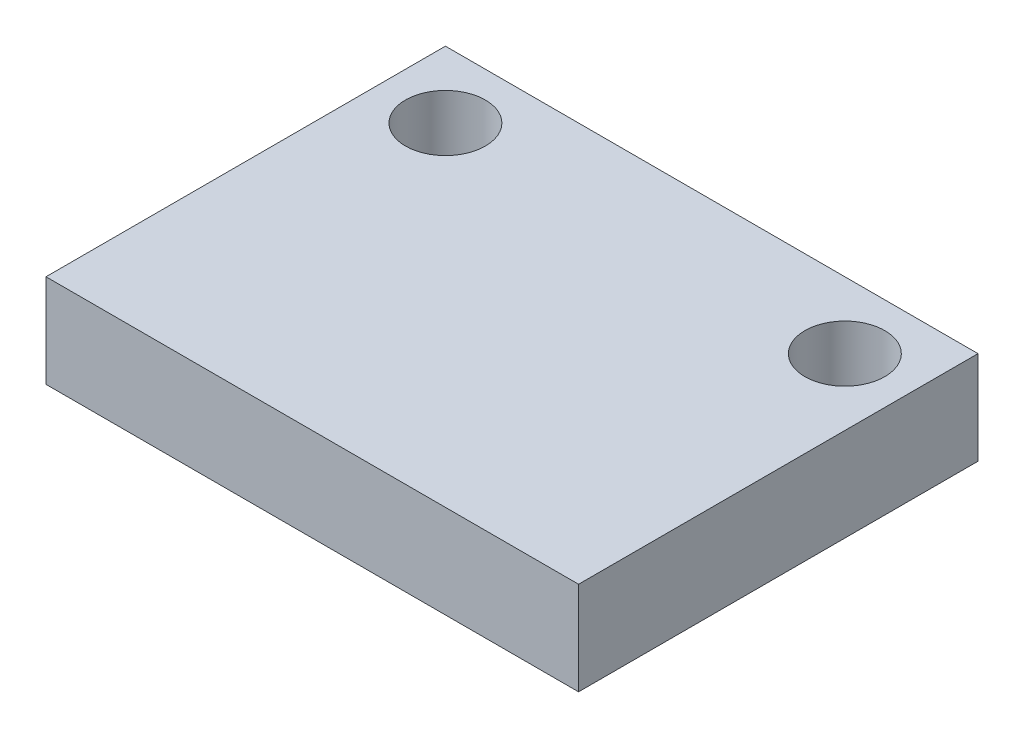
from build123d import *

# Parameters (mm, degrees)
SKETCH1_W           = 10
SKETCH1_H           = 15
SKETCH1_R           = 1.5
BOSS_EXTRUDE1_DEPTH = 3.5


with BuildPart() as part:
    # Sketch1 → Boss-Extrude1 (new body)
    # profile 1 of 2: a face of its own
    with BuildSketch(Plane(origin=(0, 0, 0), x_dir=(1, 0, 0), z_dir=(0, 1, 0))):
        with Locations((15, 7.5)):
            Rectangle(SKETCH1_W, SKETCH1_H)
        with Locations(Location((17.5, 12.5, 0), (0, 0, 270))):
            Circle(SKETCH1_R, mode=Mode.SUBTRACT)
    # profile 2 of 2: a face of its own
    with BuildSketch(Plane(origin=(0, 0, 0), x_dir=(1, 0, 0), z_dir=(0, 1, 0))):
        with Locations((5, 7.5)):
            Rectangle(SKETCH1_W, SKETCH1_H)
        with BuildLine():
            ThreePointArc((1, 12.5), (1.439339828, 13.560660172), (2.5, 14))
            ThreePointArc((2.5, 14), (3.560660172, 13.560660172), (4, 12.5))
            ThreePointArc((4, 12.5), (2.5, 11), (1, 12.5))
        make_face(mode=Mode.SUBTRACT)
    extrude(amount=BOSS_EXTRUDE1_DEPTH)


solid = part.part
